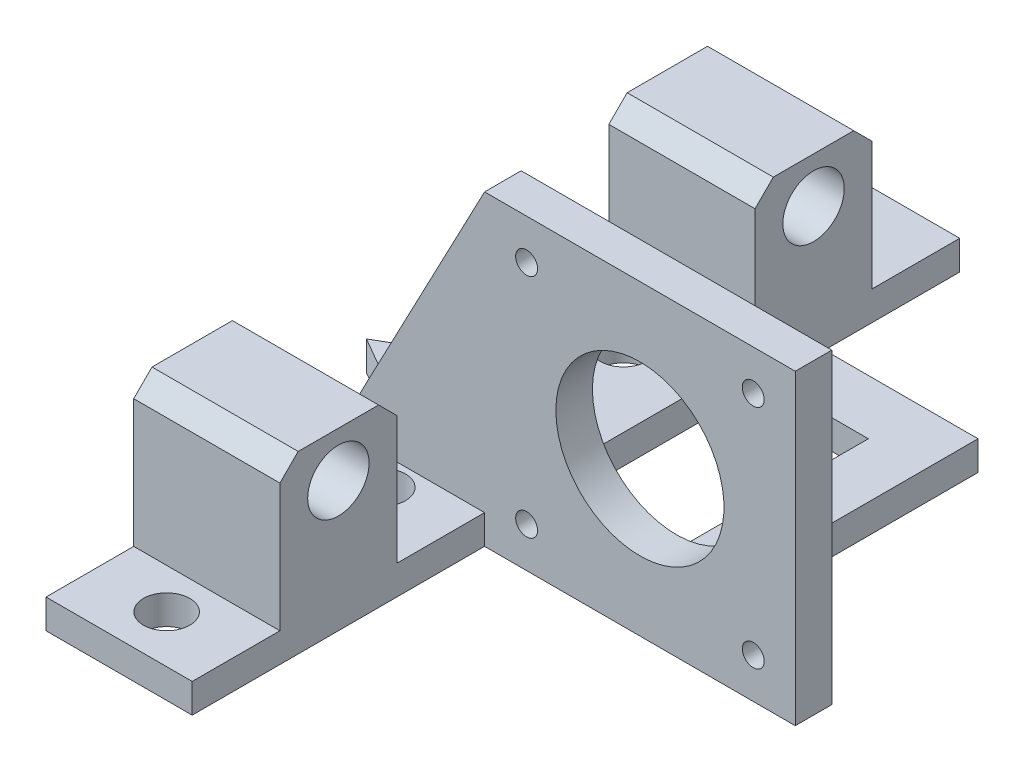
from build123d import *

# Parameters (mm, degrees)
SKETCH1_W           = 20
SKETCH1_H           = 105
BOSS_EXTRUDE1_DEPTH = 4
SKETCH2_R           = 4.2
BOSS_EXTRUDE2_DEPTH = 20
BOSS_EXTRUDE3_DEPTH = 4
SKETCH4_R           = 3.175
CUT_EXTRUDE1_DEPTH  = 109.742815855
SKETCH5_W           = 5
SKETCH5_H           = 42
BOSS_EXTRUDE4_DEPTH = 42.5
SKETCH6_R           = 11.5
SKETCH6_R_2         = 1.5
CUT_EXTRUDE2_DEPTH  = 97.282137492
BOSS_EXTRUDE5_DEPTH = 5
BOSS_EXTRUDE6_DEPTH = 4


with BuildPart() as part:
    # Sketch1 → Boss-Extrude1 (new body)
    with BuildSketch(Plane(origin=(0, 0, 0), x_dir=(1, 0, 0), z_dir=(0, 1, 0))):
        with Locations((10, 52.5)):
            Rectangle(SKETCH1_W, SKETCH1_H)
    extrude(amount=BOSS_EXTRUDE1_DEPTH)

    # Sketch2 → Boss-Extrude2 (add)
    # profile 1 of 2: a face of its own
    with BuildSketch(Plane.ZY):
        Polygon((-12, 4), (-12, 21.5), (-14.5, 24), (-25.5, 24), (-28, 21.5), (-28, 4), align=None)
        with Locations((-20, 17.8)):
            Circle(SKETCH2_R, mode=Mode.SUBTRACT)
    # profile 2 of 2: a face of its own
    with BuildSketch(Plane.ZY):
        Polygon((-93, 4), (-77, 4), (-77, 21.5), (-79.5, 24), (-90.5, 24), (-93, 21.5), align=None)
        with Locations((-85, 17.8)):
            Circle(SKETCH2_R, mode=Mode.SUBTRACT)
    extrude(amount=-BOSS_EXTRUDE2_DEPTH)

    # Sketch3 → Boss-Extrude3 (add)
    with BuildSketch(Plane.XZ):
        Polygon((0, -57.5), (-8.660254038, -52.5), (0, -47.5), align=None)
    extrude(amount=-BOSS_EXTRUDE3_DEPTH)

    # Sketch4 → Cut-Extrude1 (cut, through all)
    with BuildSketch(Plane(origin=(0, 4, 0), x_dir=(1, 0, 0), z_dir=(0, 1, 0))):
        with Locations(Location((10, 98.5, 0), (0, 0, 270))):
            Circle(SKETCH4_R)
        with Locations(Location((10, 69, 0), (0, 0, 270))):
            Circle(SKETCH4_R)
        with Locations(Location((10, 36, 0), (0, 0, 270))):
            Circle(SKETCH4_R)
        with Locations(Location((10, 6.5, 0), (0, 0, 270))):
            Circle(SKETCH4_R)
    extrude(amount=-CUT_EXTRUDE1_DEPTH, mode=Mode.SUBTRACT)

    # Sketch5 → Boss-Extrude4 (add)
    with BuildSketch(Plane(origin=(20, 0, 0), x_dir=(0, 0, -1), z_dir=(1, 0, 0))):
        with Locations((42.5, 21)):
            Rectangle(SKETCH5_W, SKETCH5_H)
    extrude(amount=BOSS_EXTRUDE4_DEPTH)

    # Sketch6 → Cut-Extrude2 (cut, through all)
    with BuildSketch(Plane(origin=(0, 0, -45), x_dir=(-1, 0, 0), z_dir=(0, 0, -1))):
        with Locations((-41.25, 21)):
            Circle(SKETCH6_R)
        with Locations((-56.75, 36.5)):
            Circle(SKETCH6_R_2)
        with Locations((-25.75, 36.5)):
            Circle(SKETCH6_R_2)
        with Locations((-25.75, 5.5)):
            Circle(SKETCH6_R_2)
        with Locations((-56.75, 5.5)):
            Circle(SKETCH6_R_2)
    extrude(amount=-CUT_EXTRUDE2_DEPTH, mode=Mode.SUBTRACT)

    # Sketch7 → Boss-Extrude5 (add)
    with BuildSketch(Plane.XY.offset(-40)):
        Polygon((20, 42), (0, 4), (20, 4), align=None)
    extrude(amount=-BOSS_EXTRUDE5_DEPTH)

    # Sketch8 → Boss-Extrude6 (add)
    with BuildSketch(Plane.XZ):
        Polygon((45, -45), (45, -82.5), (20, -82.5), (20, -75), (37.5, -75), (37.5, -45), align=None)
    extrude(amount=-BOSS_EXTRUDE6_DEPTH)


solid = part.part
